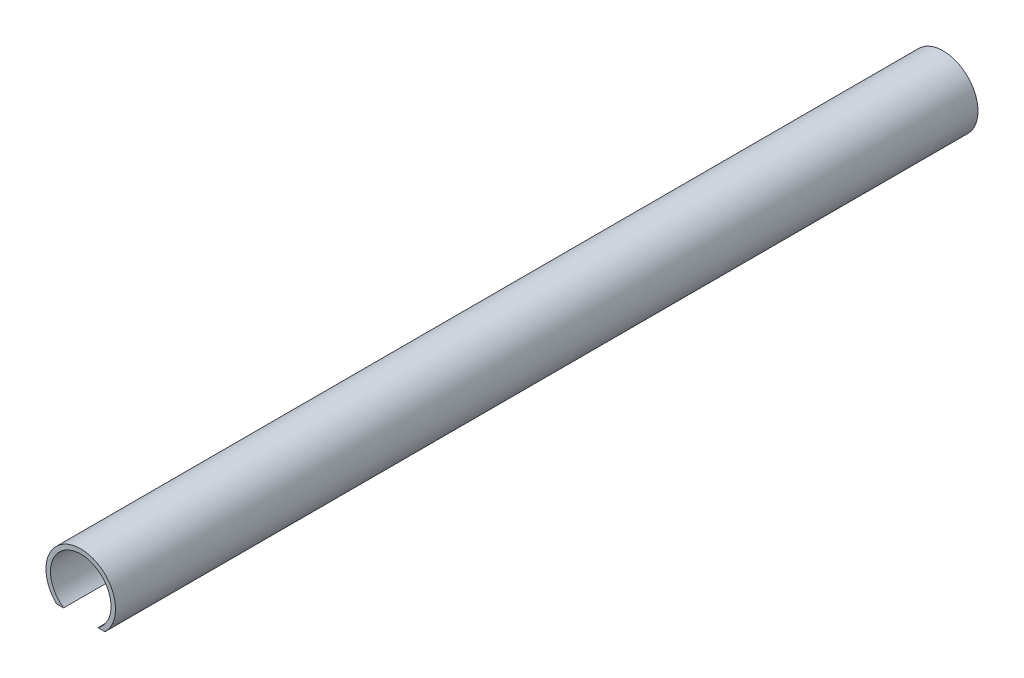
from build123d import *

# Parameters (mm, degrees)
SKETCH1_R               = 30.1625
SKETCH1_R_2             = 26.2509
BOSS_EXTRUDE1_DEPTH     = 747.903150098
CUT_EXTRUDE1_DEPTH      = 750.11859858
CUT_EXTRUDE1_DEPTH_BACK = 750.11859858
SKETCH2_W               = 57.15
SKETCH2_H               = 19.05


with BuildPart() as part:
    # Sketch1 → Boss-Extrude1 (new body)
    with BuildSketch(Plane.XY):
        with Locations(Location((0, 0, 0), (0, 0, 270))):
            Circle(SKETCH1_R)
        with Locations(Location((0, 0, 0), (0, 0, 270))):
            Circle(SKETCH1_R_2, mode=Mode.SUBTRACT)
    extrude(amount=BOSS_EXTRUDE1_DEPTH)

    # Sketch2 → Cut-Extrude1 (cut, two sides: drawn at the far end of the back side and taken through both)
    with BuildSketch(Plane(origin=(0, 0, 0), x_dir=(0, 0, -1), z_dir=(1, 0, 0)).offset(-CUT_EXTRUDE1_DEPTH_BACK)):
        Polygon((-732.028150098, -21.648424474), (-687.578150098, -21.648424474), (-687.578150098, -40.698424474), (-732.028150098, -40.698424474), (-757.696723695, -40.698424474), (-757.696723695, -21.648424474), align=None)
        with Locations((-493.303150098, -31.173424474)):
            Rectangle(SKETCH2_W, SKETCH2_H)
    extrude(amount=CUT_EXTRUDE1_DEPTH + CUT_EXTRUDE1_DEPTH_BACK, mode=Mode.SUBTRACT)


solid = part.part
